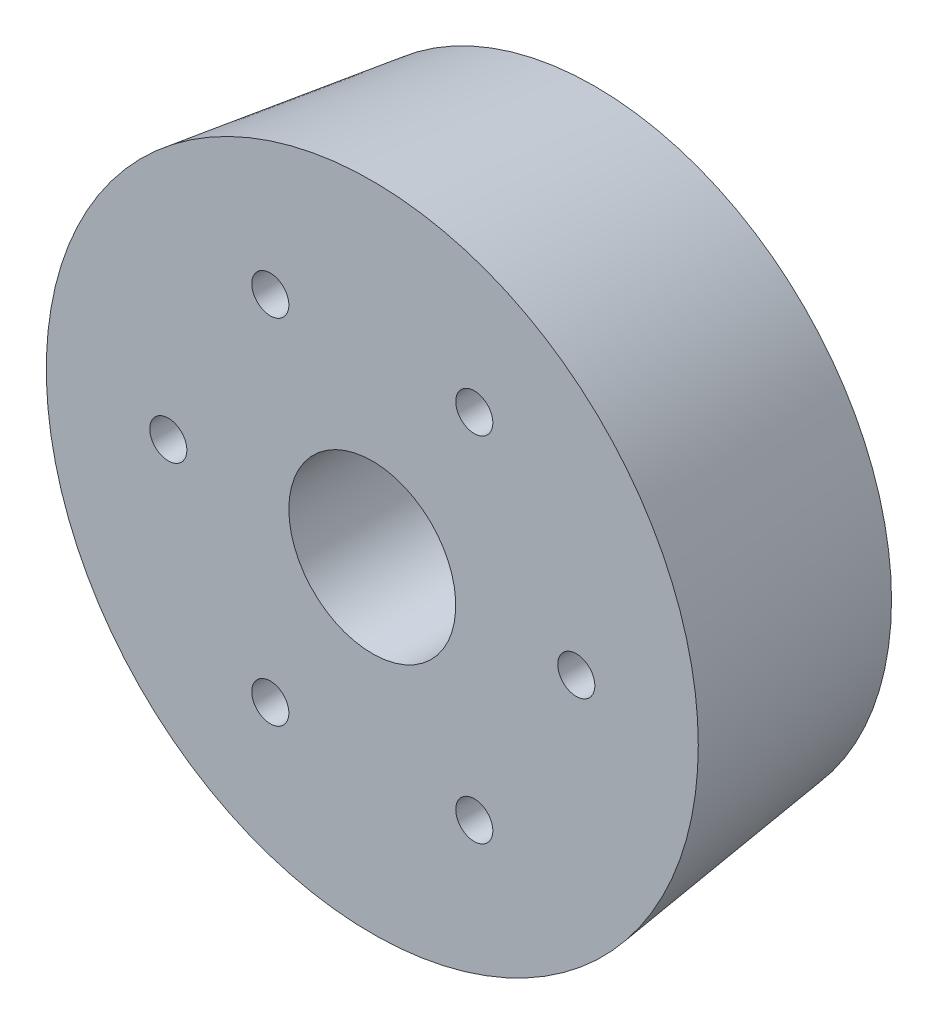
from build123d import *

# Parameters (mm, degrees)
SKETCH1_R           = 50.8
BOSS_EXTRUDE1_DEPTH = 38.1
BOSS_EXTRUDE1_DRAFT = -7.5
SKETCH2_R           = 14.2875
CUT_EXTRUDE1_DEPTH  = 38.1
SKETCH3_R           = 3.175
CUT_EXTRUDE2_DEPTH  = 38.1


with BuildPart() as part:
    # Sketch1 → Boss-Extrude1 (with draft: the straight prism first)
    with BuildSketch(Plane.XY):
        Circle(SKETCH1_R)
    extrude(amount=BOSS_EXTRUDE1_DEPTH)
    # Boss-Extrude1: the draft: its side faces are tilted about the plane it starts from
    boss_extrude1_sides = [part.faces().sort_by_distance(p)[0] for p in [
        (-50.8, 0, 19.05),
    ]]
    draft(boss_extrude1_sides, Plane.XY, BOSS_EXTRUDE1_DRAFT)

    # Sketch2 → Cut-Extrude1 (cut)
    with BuildSketch(Plane(origin=(0, 0, 0), x_dir=(-1, 0, 0), z_dir=(0, 0, -1))):
        Circle(SKETCH2_R)
    extrude(amount=-CUT_EXTRUDE1_DEPTH, mode=Mode.SUBTRACT)

    # Sketch3 → Cut-Extrude2 (cut)
    with BuildSketch(Plane(origin=(0, 0, 0), x_dir=(-1, 0, 0), z_dir=(0, 0, -1))):
        with Locations((34.925, 0)):
            Circle(SKETCH3_R)
        with Locations((17.4625, -30.245937227)):
            Circle(SKETCH3_R)
        with Locations((-17.4625, -30.245937227)):
            Circle(SKETCH3_R)
        with Locations((-34.925, 0)):
            Circle(SKETCH3_R)
        with Locations((-17.4625, 30.245937227)):
            Circle(SKETCH3_R)
        with Locations((17.4625, 30.245937227)):
            Circle(SKETCH3_R)
    extrude(amount=-CUT_EXTRUDE2_DEPTH, mode=Mode.SUBTRACT)


solid = part.part
